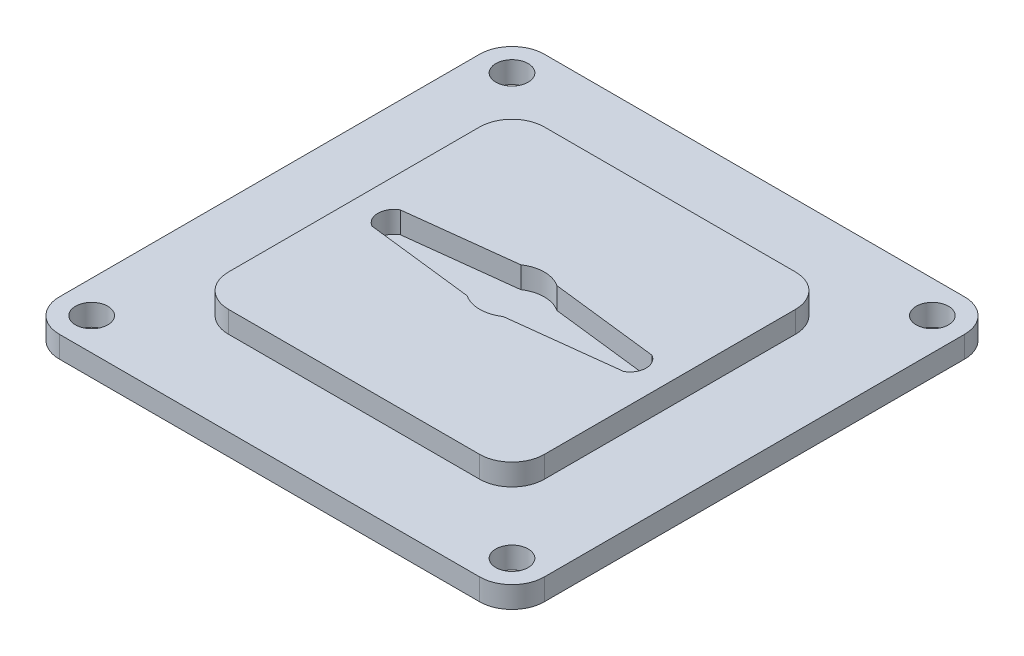
from build123d import *

# Parameters (mm, degrees)
SKETCH2_R           = 1.5
BOSS_EXTRUDE1_DEPTH = 2
BOSS_EXTRUDE2_DEPTH = 2
CUT_EXTRUDE1_DEPTH  = 2


with BuildPart() as part:
    # Sketch2 → Boss-Extrude1 (new body)
    with BuildSketch(Plane(origin=(0, 0, 0), x_dir=(1, 0, 0), z_dir=(0, 1, 0))):
        with BuildLine():
            Line((-19.5, 22.5), (19.5, 22.5))
            ThreePointArc((19.5, 22.5), (21.621320344, 21.621320344), (22.5, 19.5))
            Line((22.5, 19.5), (22.5, -19.5))
            ThreePointArc((22.5, -19.5), (21.621320344, -21.621320344), (19.5, -22.5))
            Line((19.5, -22.5), (-19.5, -22.5))
            ThreePointArc((-19.5, -22.5), (-21.621320344, -21.621320344), (-22.5, -19.5))
            Line((-22.5, -19.5), (-22.5, 19.5))
            ThreePointArc((-22.5, 19.5), (-21.621320344, 21.621320344), (-19.5, 22.5))
        make_face()
        with Locations(Location((19.5, -19.5, 0), (0, 0, 270))):
            Circle(SKETCH2_R, mode=Mode.SUBTRACT)
        with Locations(Location((19.5, 19.5, 0), (0, 0, 270))):
            Circle(SKETCH2_R, mode=Mode.SUBTRACT)
        with Locations(Location((-19.5, 19.5, 0), (0, 0, 270))):
            Circle(SKETCH2_R, mode=Mode.SUBTRACT)
        with Locations(Location((-19.5, -19.5, 0), (0, 0, 270))):
            Circle(SKETCH2_R, mode=Mode.SUBTRACT)
    extrude(amount=BOSS_EXTRUDE1_DEPTH)

    # Sketch3 → Boss-Extrude2 (add)
    with BuildSketch(Plane(origin=(0, 2, 0), x_dir=(1, 0, 0), z_dir=(0, 1, 0))):
        with BuildLine():
            Line((-11.653247837, 14.653247837), (11.653247837, 14.653247837))
            ThreePointArc((11.653247837, 14.653247837), (13.774568181, 13.774568181), (14.653247837, 11.653247837))
            Line((14.653247837, 11.653247837), (14.653247837, -11.653247837))
            ThreePointArc((14.653247837, -11.653247837), (13.774568181, -13.774568181), (11.653247837, -14.653247837))
            Line((11.653247837, -14.653247837), (-11.653247837, -14.653247837))
            ThreePointArc((-11.653247837, -14.653247837), (-13.774568181, -13.774568181), (-14.653247837, -11.653247837))
            Line((-14.653247837, -11.653247837), (-14.653247837, 11.653247837))
            ThreePointArc((-14.653247837, 11.653247837), (-13.774568181, 13.774568181), (-11.653247837, 14.653247837))
        make_face()
    extrude(amount=BOSS_EXTRUDE2_DEPTH)

    # Sketch4 → Cut-Extrude1 (cut)
    with BuildSketch(Plane(origin=(0, 4, 0), x_dir=(1, 0, 0), z_dir=(0, 1, 0))):
        with BuildLine():
            Line((11.675246151, -1.309846963), (1.675246151, -2.488684458))
            ThreePointArc((1.675246151, -2.488684458), (0, -3), (-1.675246151, -2.488684458))
            Line((-1.675246151, -2.488684458), (-11.675246151, -1.309846963))
            ThreePointArc((-11.675246151, -1.309846963), (-12.444287238, 0), (-11.675246151, 1.309846963))
            Line((-11.675246151, 1.309846963), (-1.675246151, 2.488684458))
            ThreePointArc((-1.675246151, 2.488684458), (0, 3), (1.675246151, 2.488684458))
            Line((1.675246151, 2.488684458), (11.675246151, 1.309846963))
            ThreePointArc((11.675246151, 1.309846963), (12.444287238, 0), (11.675246151, -1.309846963))
        make_face()
    extrude(amount=-CUT_EXTRUDE1_DEPTH, mode=Mode.SUBTRACT)


solid = part.part
